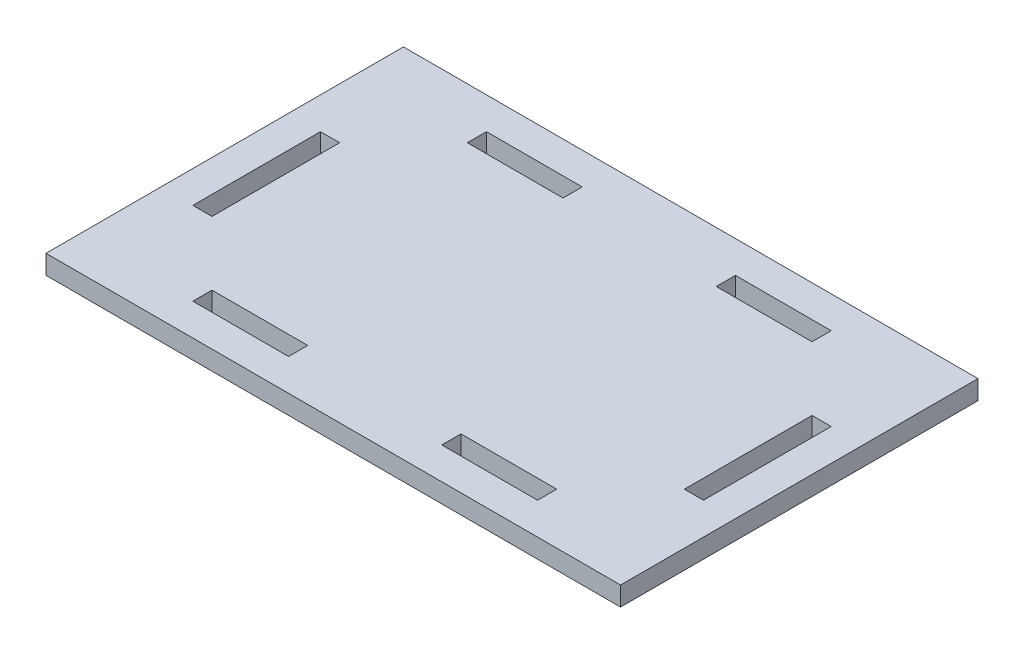
from build123d import *

# Parameters (mm, degrees)
SKETCH_1_W      = 90
SKETCH_1_H      = 56
SKETCH_1_W_2    = 3
SKETCH_1_H_2    = 20
SKETCH_1_W_3    = 15
SKETCH_1_H_3    = 3
EXTRUDE_1_DEPTH = 3


with BuildPart() as part:
    # 草图1 → 凸台-拉伸1 (new body)
    with BuildSketch(Plane(origin=(0, 0, 0), x_dir=(1, 0, 0), z_dir=(0, 1, 0))):
        Rectangle(SKETCH_1_W, SKETCH_1_H)
        with Locations((-38.5, 0)):
            Rectangle(SKETCH_1_W_2, SKETCH_1_H_2, mode=Mode.SUBTRACT)
        with Locations((38.5, 0)):
            Rectangle(SKETCH_1_W_2, SKETCH_1_H_2, mode=Mode.SUBTRACT)
        with Locations((19.5, 21.5)):
            Rectangle(SKETCH_1_W_3, SKETCH_1_H_3, mode=Mode.SUBTRACT)
        with Locations((-19.5, 21.5)):
            Rectangle(SKETCH_1_W_3, SKETCH_1_H_3, mode=Mode.SUBTRACT)
        with Locations((19.5, -21.5)):
            Rectangle(SKETCH_1_W_3, SKETCH_1_H_3, mode=Mode.SUBTRACT)
        with Locations((-19.5, -21.5)):
            Rectangle(SKETCH_1_W_3, SKETCH_1_H_3, mode=Mode.SUBTRACT)
    extrude(amount=EXTRUDE_1_DEPTH)


solid = part.part
